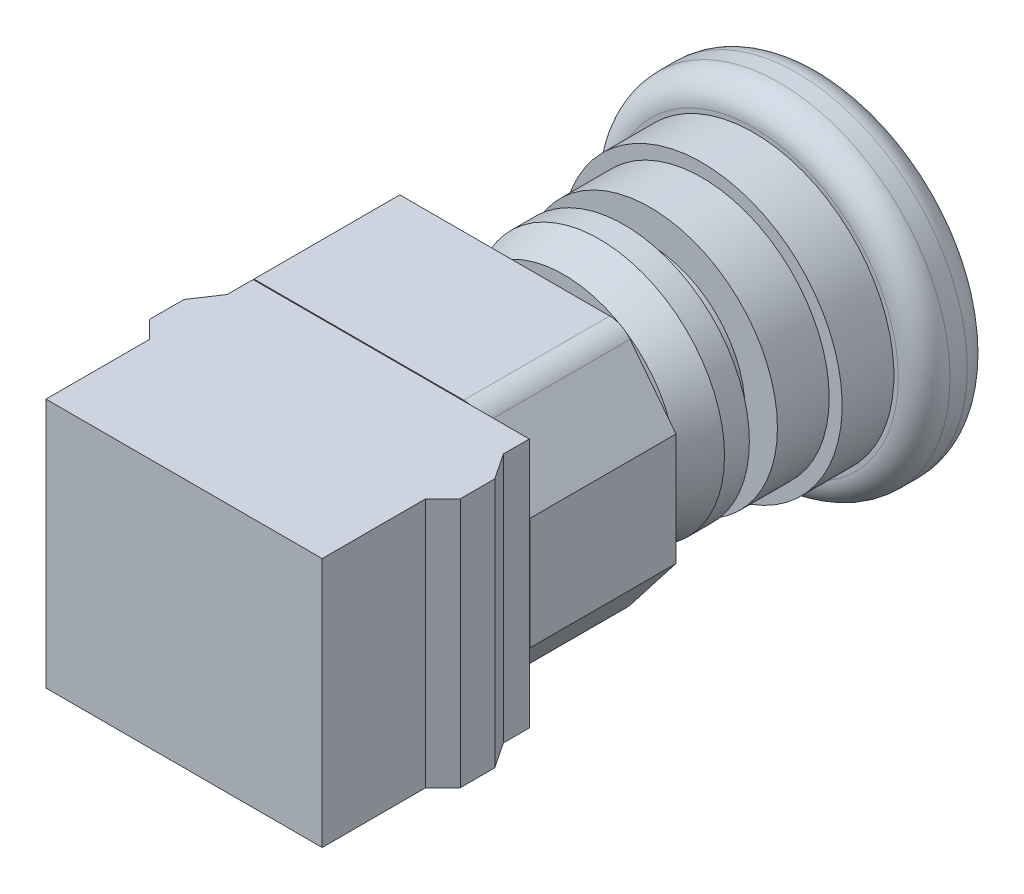
from build123d import *

# Parameters (mm, degrees)
SKETCH_1_W          = 32
SKETCH_1_H          = 29
EXTRUDE_1_DEPTH     = 12
EXTRUDE_2_DEPTH     = 29
SKETCH_3_R          = 11
EXTRUDE_3_DEPTH     = 17
SKETCH_4_R          = 11
EXTRUDE_4_DEPTH     = 3
SKETCH_5_R          = 14.5
EXTRUDE_6_DEPTH     = 10
SKETCH_6_R          = 14.75
EXTRUDE_7_DEPTH     = 6
SKETCH_7_R          = 16.25
EXTRUDE_8_DEPTH     = 6
SKETCH_8_R          = 19.75
EXTRUDE_9_DEPTH     = 8
CUT_EXTRUDE_START   = 3
SKETCH_9_R          = 22.553802592
SKETCH_9_R_2        = 11
CUT_EXTRUDE_1_DEPTH = 3
CHAMFER_1_SIZE      = 1.5
CHAMFER_1_SIZE2     = 4.121216129
FILLET_1_R          = 3
FILLET_2_R          = 3
CUT_EXTRUDE_START_2 = 0.1
CUT_EXTRUDE_2_DEPTH = 0.1


with BuildPart() as part:
    # 草图1 → 凸台-拉伸1 (new body)
    with BuildSketch(Plane.XY):
        with Locations((16, -14.5)):
            Rectangle(SKETCH_1_W, SKETCH_1_H)
    extrude(amount=EXTRUDE_1_DEPTH)

    # 草图2 → 凸台-拉伸2 (add)
    with BuildSketch(Plane(origin=(0, 0, 0), x_dir=(1, 0, 0), z_dir=(0, 1, 0))):
        Polygon((0, 0), (-2, 2), (-2, 6), (0, 9), (0, 12), (29.3, 12), (32, 12), (32, 9), (34, 6), (34, 2), (32, 0), align=None)
    extrude(amount=-EXTRUDE_2_DEPTH)

    # 草图3 → 凸台-拉伸3 (add)
    with BuildSketch(Plane(origin=(0, 0, -12), x_dir=(-1, 0, 0), z_dir=(0, 0, -1))):
        Polygon((0, 0), (-25.777777778, 0), (-32, -8), (-32, -21), (-25.777777778, -29), (0, -29), align=None)
        with Locations((-16, -14.5)):
            Circle(SKETCH_3_R, mode=Mode.SUBTRACT)
    extrude(amount=EXTRUDE_3_DEPTH)

    # 圆角2
    fillet_2_edges = [part.edges().sort_by_distance(p)[0] for p in [
        (25.777777778, 0, -20.5),
        (25.777777778, -29, -20.5),
    ]]
    fillet(fillet_2_edges, radius=FILLET_2_R)

    # 草图10 → 切除-拉伸2 (cut)
    with BuildSketch(Plane(origin=(0, 0, -12), x_dir=(-1, 0, 0), z_dir=(0, 0, -1)).offset(CUT_EXTRUDE_START_2)):
        with BuildLine():
            Line((-32, -8), (-32, -21))
            Line((-32, -21), (-26.678583013, -27.841821841))
            ThreePointArc((-26.678583013, -27.841821841), (-25.628580699, -28.694945781), (-24.310526361, -29))
            Line((-24.310526361, -29), (0, -29))
            Line((0, -29), (0, 0))
            Line((0, 0), (-24.310526361, 0))
            ThreePointArc((-24.310526361, 0), (-25.628580699, -0.305054219), (-26.678583013, -1.158178159))
            Line((-26.678583013, -1.158178159), (-32, -8))
        make_face()
        with BuildLine():
            Line((-31.9, -8.034310775), (-31.9, -20.965689225))
            Line((-31.9, -20.965689225), (-26.599647791, -27.780427779))
            ThreePointArc((-26.599647791, -27.780427779), (-25.584645555, -28.605114255), (-24.310526361, -28.9))
            Line((-24.310526361, -28.9), (-0.1, -28.9))
            Line((-0.1, -28.9), (-0.1, -0.1))
            Line((-0.1, -0.1), (-24.310526361, -0.1))
            ThreePointArc((-24.310526361, -0.1), (-25.584645555, -0.394885745), (-26.599647791, -1.219572221))
            Line((-26.599647791, -1.219572221), (-31.9, -8.034310775))
        make_face(mode=Mode.SUBTRACT)
    extrude(amount=-CUT_EXTRUDE_2_DEPTH, mode=Mode.SUBTRACT)


with BuildPart() as body_2:
    # 草图4 → 凸台-拉伸4 (new body)
    with BuildSketch(Plane(origin=(0, 0, -29), x_dir=(-1, 0, 0), z_dir=(0, 0, -1))):
        with Locations((-16, -14.5)):
            Circle(SKETCH_4_R)
    extrude(amount=EXTRUDE_4_DEPTH)

    # 草图5 → 凸台-拉伸6 (add)
    with BuildSketch(Plane(origin=(0, 0, -32), x_dir=(-1, 0, 0), z_dir=(0, 0, -1))):
        with Locations((-16, -14.5)):
            Circle(SKETCH_5_R)
    extrude(amount=EXTRUDE_6_DEPTH)

    # 草图6 → 凸台-拉伸7 (add)
    with BuildSketch(Plane(origin=(0, 0, -42), x_dir=(-1, 0, 0), z_dir=(0, 0, -1))):
        with Locations((-16, -14.5)):
            Circle(SKETCH_6_R)
    extrude(amount=EXTRUDE_7_DEPTH)

    # 草图7 → 凸台-拉伸8 (add)
    with BuildSketch(Plane(origin=(0, 0, -48), x_dir=(-1, 0, 0), z_dir=(0, 0, -1))):
        with Locations((-16, -14.5)):
            Circle(SKETCH_7_R)
    extrude(amount=EXTRUDE_8_DEPTH)

    # 草图8 → 凸台-拉伸9 (add)
    with BuildSketch(Plane(origin=(0, 0, -54), x_dir=(-1, 0, 0), z_dir=(0, 0, -1))):
        with Locations((-16, -14.5)):
            Circle(SKETCH_8_R)
    extrude(amount=EXTRUDE_9_DEPTH)

    # 草图9 → 切除-拉伸1 (cut)
    with BuildSketch(Plane.XY.offset(-42).offset(CUT_EXTRUDE_START)):
        with Locations((16, -14.5)):
            Circle(SKETCH_9_R)
        with Locations((16, -14.5)):
            Circle(SKETCH_9_R_2, mode=Mode.SUBTRACT)
    extrude(amount=-CUT_EXTRUDE_1_DEPTH, mode=Mode.SUBTRACT)

    # 倒角1
    chamfer_1_edges = [body_2.edges().sort_by_distance(p)[0] for p in [
        (30.5, -14.5, -32),
    ]]
    chamfer_1_side = [body_2.faces().sort_by_distance(p)[0] for p in [
        (30.089878067, -14.5, -32),
    ]]
    chamfer(chamfer_1_edges, length=CHAMFER_1_SIZE, length2=CHAMFER_1_SIZE2, reference=chamfer_1_side[0])

    # 圆角1
    fillet_1_edges = [body_2.edges().sort_by_distance(p)[0] for p in [
        (35.75, -14.5, -54),
        (35.75, -14.5, -62),
    ]]
    fillet(fillet_1_edges, radius=FILLET_1_R)


solid = Compound([part.part, body_2.part])
